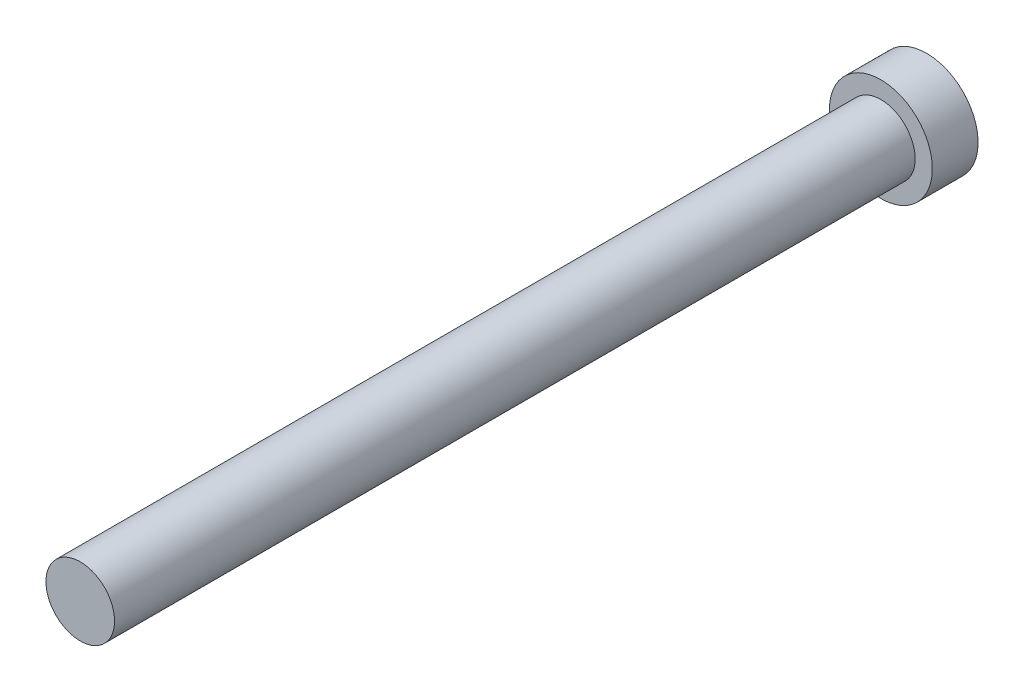
from build123d import *

# Parameters (mm, degrees)
SKETCH2_R           = 1.5
BOSS_EXTRUDE1_DEPTH = 35
SKETCH3_R           = 2.25
BOSS_EXTRUDE2_DEPTH = 2


with BuildPart() as part:
    # Sketch2 → Boss-Extrude1 (new body)
    with BuildSketch(Plane.XY):
        Circle(SKETCH2_R)
    extrude(amount=BOSS_EXTRUDE1_DEPTH)

    # Sketch3 → Boss-Extrude2 (add)
    with BuildSketch(Plane(origin=(0, 0, 0), x_dir=(-1, 0, 0), z_dir=(0, 0, -1))):
        Circle(SKETCH3_R)
    extrude(amount=BOSS_EXTRUDE2_DEPTH)


solid = part.part
